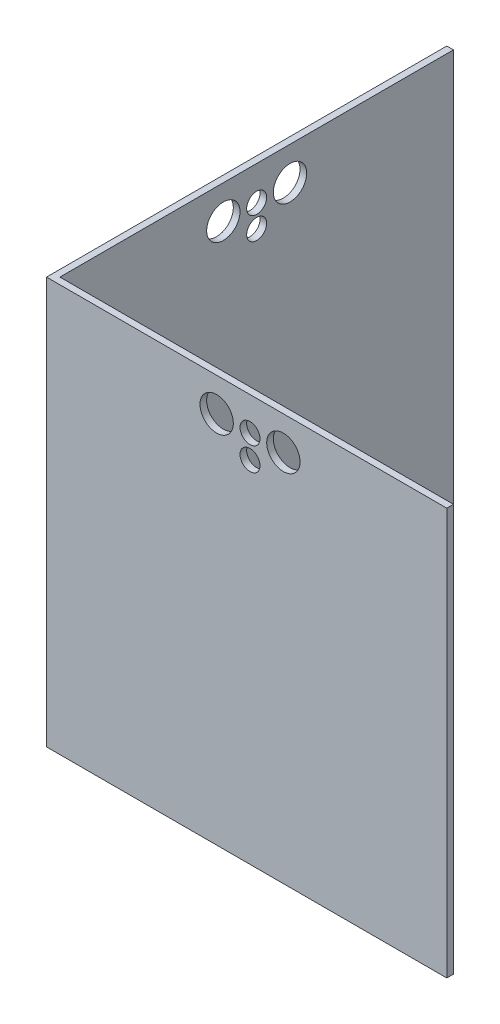
from build123d import *

# Parameters (mm, degrees)
EXTRUDE_1_DEPTH     = 2
EXTRUDE_2_DEPTH     = 120
SKETCH_3_R          = 5
SKETCH_3_R_2        = 3
CUT_EXTRUDE_1_DEPTH = 2
SKETCH_4_R          = 5
SKETCH_4_R_2        = 3
CUT_EXTRUDE_2_DEPTH = 2
SKETCH_5_R          = 3
CUT_EXTRUDE_3_DEPTH = 2


with BuildPart() as part:
    # 草图1 → 凸台-拉伸1 (new body)
    with BuildSketch(Plane(origin=(0, 0, 0), x_dir=(1, 0, 0), z_dir=(0, 1, 0))):
        with BuildLine():
            Line((-71.645096328, 99.585522078), (-71.645096328, -20.414477922))
            Line((-71.645096328, -20.414477922), (48.354903672, -20.414477922))
            Line((48.354903672, -20.414477922), (48.354903672, -18.414477922))
            Line((48.354903672, -18.414477922), (-1.806261563, 31.746687313))
            ThreePointArc((-1.806261563, 31.746687313), (-19.483931092, 31.746687313), (-19.483931092, 49.424356842))
            Line((-19.483931092, 49.424356842), (-69.645096328, 99.585522078))
            Line((-69.645096328, 99.585522078), (-71.645096328, 99.585522078))
        make_face()
    extrude(amount=EXTRUDE_1_DEPTH)

    # 草图2 → 凸台-拉伸2 (add)
    with BuildSketch(Plane(origin=(0, 2, 0), x_dir=(1, 0, 0), z_dir=(0, 1, 0))):
        Polygon((-69.645096328, 99.585522078), (-69.645096328, -18.414477922), (48.354903672, -18.414477922), (48.354903672, -20.414477922), (-71.645096328, -20.414477922), (-71.645096328, 99.585522078), align=None)
    extrude(amount=EXTRUDE_2_DEPTH)

    # 草图3 → 切除-拉伸1 (cut)
    with BuildSketch(Plane(origin=(0, 0, 18.414477922), x_dir=(-1, 0, 0), z_dir=(0, 0, -1))):
        with Locations((0.645096328, 112)):
            Circle(SKETCH_3_R)
        with Locations((20.645096328, 112)):
            Circle(SKETCH_3_R)
        with Locations((10.645096328, 112)):
            Circle(SKETCH_3_R_2)
    extrude(amount=-CUT_EXTRUDE_1_DEPTH, mode=Mode.SUBTRACT)

    # 草图4 → 切除-拉伸2 (cut)
    with BuildSketch(Plane(origin=(-69.645096328, 0, 0), x_dir=(0, 0, -1), z_dir=(1, 0, 0))):
        with Locations((30.585522078, 112)):
            Circle(SKETCH_4_R)
        with Locations((50.585522078, 112)):
            Circle(SKETCH_4_R)
        with Locations((40.585522078, 111.785381459)):
            Circle(SKETCH_4_R_2)
        with Locations((40.585522078, 104.992052501)):
            Circle(SKETCH_4_R_2)
    extrude(amount=-CUT_EXTRUDE_2_DEPTH, mode=Mode.SUBTRACT)

    # 草图5 → 切除-拉伸3 (cut)
    with BuildSketch(Plane(origin=(0, 0, 18.414477922), x_dir=(-1, 0, 0), z_dir=(0, 0, -1))):
        with Locations((10.645096328, 105)):
            Circle(SKETCH_5_R)
    extrude(amount=-CUT_EXTRUDE_3_DEPTH, mode=Mode.SUBTRACT)


solid = part.part
